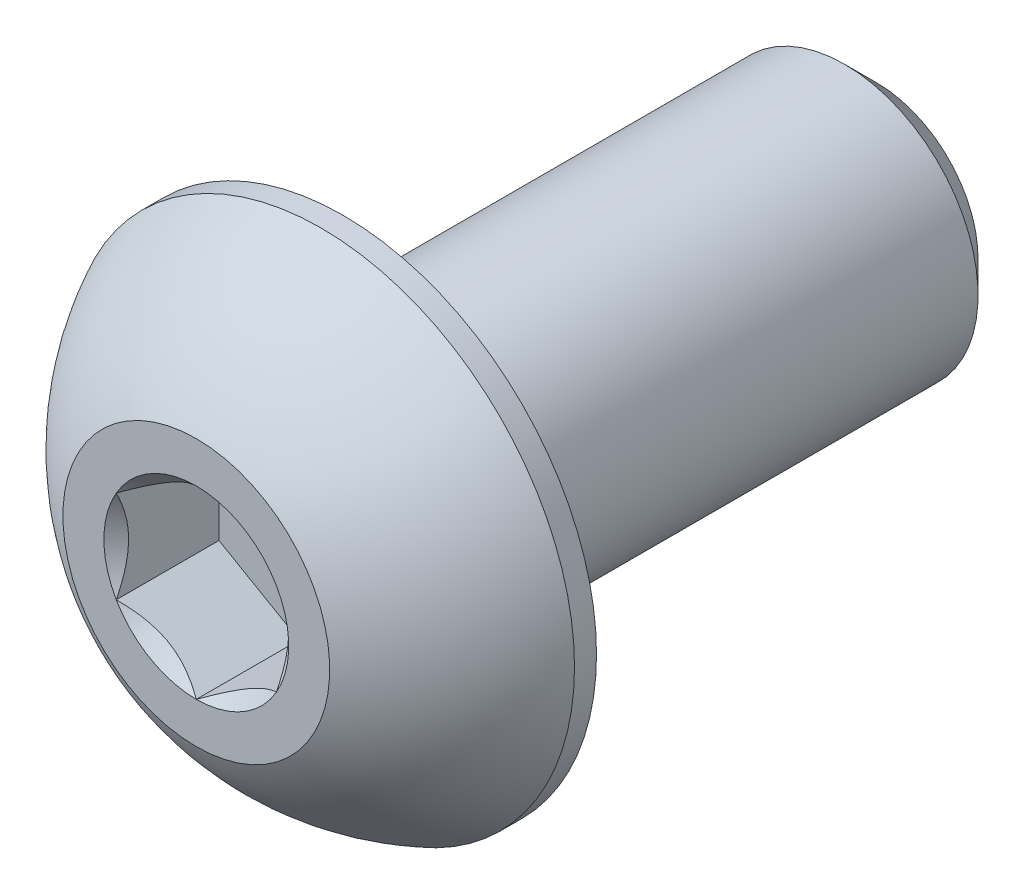
from build123d import *

# Parameters (mm, degrees)
SKETCH1_W          = 10
SKETCH1_H          = 2.5
CHAMFER1_SIZE      = 0.6
CUT_EXTRUDE2_DEPTH = 1.925


with BuildPart() as part:
    # Sketch1 → Revolve1 (revolve)
    with BuildSketch(Plane(origin=(0, 0, 0), x_dir=(0, 0, -1), z_dir=(1, 0, 0))):
        with Locations((7.75, 1.25)):
            Rectangle(SKETCH1_W, SKETCH1_H)
    revolve(axis=Axis((0, 0, -12.75), (0, 0, 1)))

    # Chamfer1
    chamfer1_edges = [part.edges().sort_by_distance(p)[0] for p in [
        (0, -2.5, -12.75),
    ]]
    chamfer(chamfer1_edges, length=CHAMFER1_SIZE)

    # Sketch7 → Revolve2 (revolve)
    with BuildSketch(Plane(origin=(0, 0, 0), x_dir=(0, 0, -1), z_dir=(1, 0, 0))):
        with BuildLine():
            Line((2.3375, 4.75), (2.75, 4.75))
            Line((2.75, 4.75), (2.75, 0))
            Line((2.75, 0), (0, 0))
            Line((0, 0), (0, 2.5))
            ThreePointArc((0, 2.5), (0.991875183, 3.808753282), (2.3375, 4.75))
        make_face()
    revolve(axis=Axis((0, 0, 0), (0, 0, -1)))

    # Sketch5 → Cut-Extrude2 (cut)
    with BuildSketch(Plane.XY):
        Polygon((1.5, -0.866025404), (1.5, 0.866025404), (0, 1.732050808), (-1.5, 0.866025404), (-1.5, -0.866025404), (0, -1.732050808), align=None)
    extrude(amount=-CUT_EXTRUDE2_DEPTH, mode=Mode.SUBTRACT)

    # Cut-Extrude3 cone 1 section (through the dimple's axis) → Cut-Extrude3 (revolve, cut)
    with BuildSketch(Plane(origin=(0, 0, 0), x_dir=(0, -1, 0), z_dir=(1, 0, 0))):
        Polygon((0, 0), (1.732050808, 0), (0, 1.732050808), align=None)
    revolve(axis=Axis((0, 0, 0), (0, 0, -1)), mode=Mode.SUBTRACT)


solid = part.part
